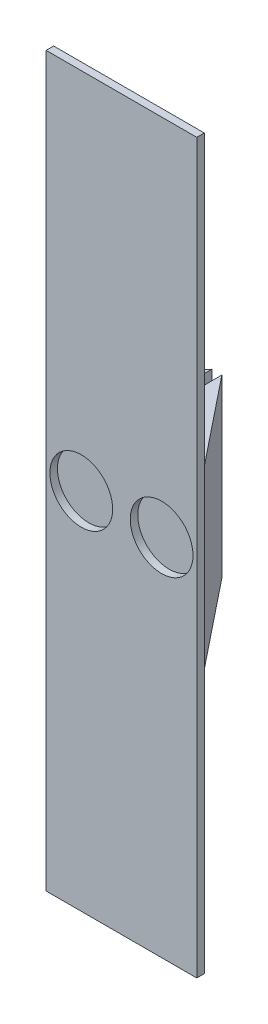
from build123d import *

# Parameters (mm, degrees)
SKETCH_1_W          = 60
SKETCH_1_H          = 60
EXTRUDE_1_DEPTH     = 3
SKETCH_2_W          = 28
SKETCH_2_H          = 60
EXTRUDE_2_DEPTH     = 35
CUT_EXTRUDE_1_DEPTH = 60
SKETCH_4_R          = 12.5
CUT_EXTRUDE_2_DEPTH = 3
EXTRUDE_3_DEPTH     = 110
EXTRUDE_4_DEPTH     = 110
CUT_EXTRUDE_3_DEPTH = 100
CUT_EXTRUDE_5_DEPTH = 110
SKETCH_12_W         = 60
SKETCH_12_H         = 3
EXTRUDE_5_DEPTH     = 5
SKETCH_13_W         = 60
SKETCH_13_H         = 3
EXTRUDE_6_DEPTH     = 5


with BuildPart() as part:
    # 草图1 → 凸台-拉伸1 (new body)
    with BuildSketch(Plane.XY):
        with Locations((14.347634014, 11.597850928)):
            Rectangle(SKETCH_1_W, SKETCH_1_H)
    extrude(amount=EXTRUDE_1_DEPTH)

    # 草图2 → 凸台-拉伸2 (add)
    with BuildSketch(Plane(origin=(0, 0, 0), x_dir=(-1, 0, 0), z_dir=(0, 0, -1))):
        with Locations((-30.347634014, 11.597850928)):
            Rectangle(SKETCH_2_W, SKETCH_2_H)
        with Locations((1.652365986, 11.597850928)):
            Rectangle(SKETCH_2_W, SKETCH_2_H)
    extrude(amount=EXTRUDE_2_DEPTH)

    # 草图3 → 切除-拉伸1 (cut)
    with BuildSketch(Plane(origin=(0, 41.597850928, 0), x_dir=(1, 0, 0), z_dir=(0, 1, 0))):
        Polygon((16.347634014, 35), (44.347634014, 0), (44.347634014, 35), align=None)
        Polygon((12.347634014, 35), (-15.652365986, 0), (-15.652365986, 35), align=None)
    extrude(amount=-CUT_EXTRUDE_1_DEPTH, mode=Mode.SUBTRACT)

    # 草图4 → 切除-拉伸2 (cut)
    with BuildSketch(Plane.XY.offset(3)):
        with Locations((-1.652365986, 11.597850928)):
            Circle(SKETCH_4_R)
        with Locations((30.347634014, 11.597850928)):
            Circle(SKETCH_4_R)
    extrude(amount=-CUT_EXTRUDE_2_DEPTH, mode=Mode.SUBTRACT)

    # 草图5 → 凸台-拉伸3 (add)
    with BuildSketch(Plane(origin=(0, 41.597850928, 0), x_dir=(1, 0, 0), z_dir=(0, 1, 0))):
        Polygon((12.347634014, 35), (12.347634014, 0), (16.347634014, 0), (16.347634014, 20), (44.347634014, 0), (44.347634014, -3), (-15.652365986, -3), (-15.652365986, 0), align=None)
    extrude(amount=EXTRUDE_3_DEPTH)

    # 草图6 → 凸台-拉伸4 (add)
    with BuildSketch(Plane.XZ.offset(18.402149072)):
        Polygon((-15.652365986, 3), (-15.652365986, 0), (12.347634014, -35), (12.347634014, 0), (16.347634014, 0), (16.347634014, -35), (44.347634014, 0), (44.347634014, 3), align=None)
    extrude(amount=EXTRUDE_4_DEPTH)

    # 草图7 → 切除-拉伸3 (cut)
    with BuildSketch(Plane.XZ.offset(128.402149072)):
        Polygon((44.347634014, 0), (16.347634014, -35), (16.347634014, 0), align=None)
        Polygon((12.347634014, -35), (-15.652365986, 0), (12.347634014, 0), align=None)
    extrude(amount=-CUT_EXTRUDE_3_DEPTH, mode=Mode.SUBTRACT)

    # 草图9 → 切除-拉伸5 (cut)
    with BuildSketch(Plane(origin=(0, 151.597850928, 0), x_dir=(1, 0, 0), z_dir=(0, 1, 0))):
        Polygon((-15.652365986, 0), (12.347634014, 0), (12.347634014, 35), align=None)
        Polygon((16.347634014, 0), (44.347634014, 0), (16.347634014, 20), align=None)
    extrude(amount=-CUT_EXTRUDE_5_DEPTH, mode=Mode.SUBTRACT)

    # 草图12 → 凸台-拉伸5 (add)
    with BuildSketch(Plane(origin=(0, -128.402149072, 0), x_dir=(-1, 0, 0), z_dir=(0, -1, 0))):
        with Locations((-14.347634014, -1.5)):
            Rectangle(SKETCH_12_W, SKETCH_12_H)
    extrude(amount=EXTRUDE_5_DEPTH)

    # 草图13 → 凸台-拉伸6 (add)
    with BuildSketch(Plane(origin=(0, 151.597850928, 0), x_dir=(1, 0, 0), z_dir=(0, 1, 0))):
        with Locations((14.347634014, -1.5)):
            Rectangle(SKETCH_13_W, SKETCH_13_H)
    extrude(amount=EXTRUDE_6_DEPTH)


solid = part.part
